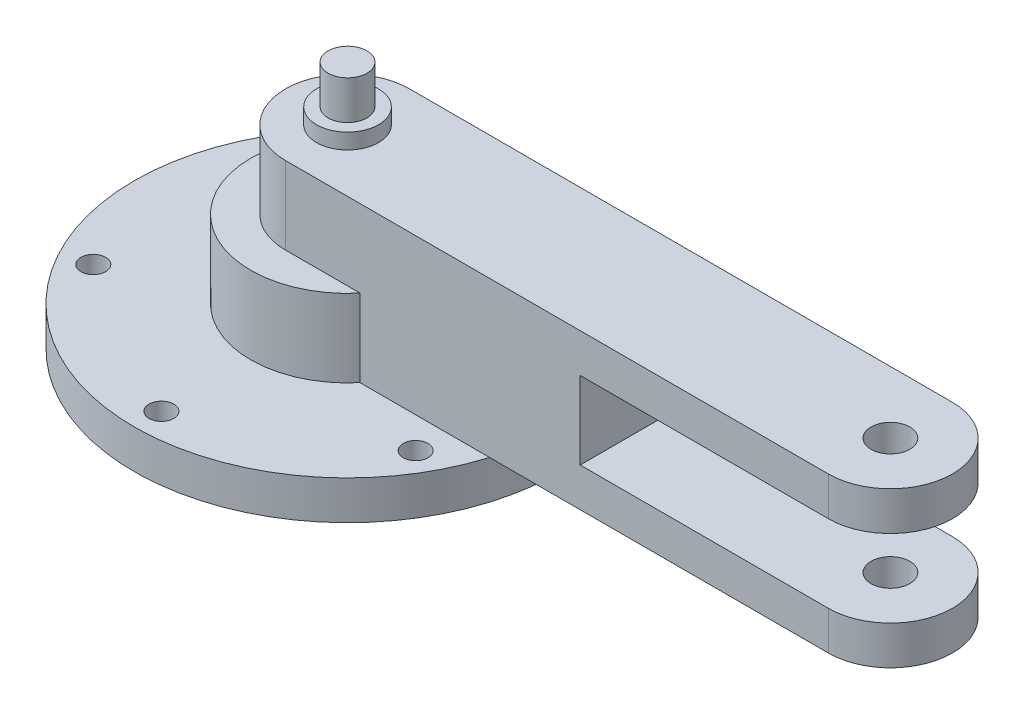
from build123d import *

# Parameters (mm, degrees)
EXTRUDE_1_DEPTH          = 10
CUT_EXTRUDE_1_REACH      = 82.25
SKETCH_3_W               = 40
SKETCH_3_H               = 10
CUT_EXTRUDE_2_REACH      = 82.92
SKETCH_4_R               = 2.5
SKETCH_5_R               = 27.5
EXTRUDE_2_DEPTH          = 5
CUT_EXTRUDE_3_REACH      = 87.09
SKETCH_6_R               = 1.6
PATTERN_CIRCULAR_1_COUNT = 6
SKETCH_7_R               = 12.5
EXTRUDE_3_DEPTH          = 10
SKETCH_8_R               = 4
EXTRUDE_4_DEPTH          = 2
SKETCH_9_R               = 2.5
EXTRUDE_5_DEPTH          = 5


with BuildPart() as part:
    # 草图2 → 凸台-拉伸1 (new, symmetric)
    with BuildSketch(Plane(origin=(0, 0, 0), x_dir=(1, 0, 0), z_dir=(0, 1, 0))):
        with BuildLine():
            Line((0, 8), (70, 8))
            ThreePointArc((70, 8), (78, 0), (70, -8))
            Line((70, -8), (0, -8))
            ThreePointArc((0, -8), (-8, 0), (0, 8))
        make_face()
    extrude(amount=EXTRUDE_1_DEPTH, both=True)

    # 草图3 → 切除-拉伸1 (cut, up to next)
    with BuildSketch(Plane.XY.offset(8), mode=Mode.PRIVATE) as cut_extrude_1_sk1:
        with Locations((58, 0)):
            Rectangle(SKETCH_3_W, SKETCH_3_H)
    cut_extrude_1_tool1 = extrude(cut_extrude_1_sk1.sketch, amount=-CUT_EXTRUDE_1_REACH, mode=Mode.PRIVATE) & part.part
    add(cut_extrude_1_tool1.solids().sort_by_distance((58, 0, 8))[0], mode=Mode.SUBTRACT)

    # 切除-拉伸2: up to this face of the body (flat: up to its plane)
    cut_extrude_2_end = Plane(part.part.faces().sort_by_distance((35, -10, 0))[0])
    # 草图4 → 切除-拉伸2 (cut, up to the picked face)
    with BuildSketch(Plane(origin=(0, 10, 0), x_dir=(1, 0, 0), z_dir=(0, 1, 0)), mode=Mode.PRIVATE) as cut_extrude_2_sk1:
        with Locations(Location((70, 0, 0), (0, 0, 270))):
            Circle(SKETCH_4_R)
    cut_extrude_2_tool1 = split(extrude(cut_extrude_2_sk1.sketch, amount=-CUT_EXTRUDE_2_REACH, mode=Mode.PRIVATE), bisect_by=cut_extrude_2_end, keep=Keep.BOTH, mode=Mode.PRIVATE)
    add(cut_extrude_2_tool1.solids().sort_by(Axis((70, 10, 0), (0, -1, 0)))[0], mode=Mode.SUBTRACT)

    # 草图5 → 凸台-拉伸2 (add)
    with BuildSketch(Plane.XZ.offset(10)):
        with Locations(Location((0, 0, 0), (0, 0, 16.912389803))):
            Circle(SKETCH_5_R)
    extrude(amount=EXTRUDE_2_DEPTH)

    # 草图6 → 切除-拉伸3 (cut, up to next)
    with BuildSketch(Plane(origin=(0, -10, 0), x_dir=(1, 0, 0), z_dir=(0, 1, 0)), mode=Mode.PRIVATE) as cut_extrude_3_sk1:
        with Locations(Location((0, 24, 0), (0, 0, 270))):
            Circle(SKETCH_6_R)
    cut_extrude_3_tool1 = extrude(cut_extrude_3_sk1.sketch, amount=-CUT_EXTRUDE_3_REACH, mode=Mode.PRIVATE) & part.part
    cut_extrude_3 = cut_extrude_3_tool1.solids().sort_by_distance((0, -10, -24))[0]
    add(cut_extrude_3, mode=Mode.SUBTRACT)

    # 阵列(圆周)1: 切除-拉伸3 ×6 about axis
    pattern_circular_1_axis = Axis((0, 0, 0), (0, 1, 0))
    for i in range(1, PATTERN_CIRCULAR_1_COUNT):
        add(cut_extrude_3.rotate(pattern_circular_1_axis, i * 360 / PATTERN_CIRCULAR_1_COUNT), mode=Mode.SUBTRACT)

    # 草图7 → 凸台-拉伸3 (add)
    with BuildSketch(Plane(origin=(0, -10, 0), x_dir=(1, 0, 0), z_dir=(0, 1, 0))):
        Circle(SKETCH_7_R)
    extrude(amount=EXTRUDE_3_DEPTH)

    # 草图8 → 凸台-拉伸4 (add)
    with BuildSketch(Plane(origin=(0, 10, 0), x_dir=(1, 0, 0), z_dir=(0, 1, 0))):
        with Locations(Location((0, 0, 0), (0, 0, 270))):
            Circle(SKETCH_8_R)
    extrude(amount=EXTRUDE_4_DEPTH)

    # 草图9 → 凸台-拉伸5 (add)
    with BuildSketch(Plane(origin=(0, 12, 0), x_dir=(1, 0, 0), z_dir=(0, 1, 0))):
        with Locations(Location((0, 0, 0), (0, 0, 270))):
            Circle(SKETCH_9_R)
    extrude(amount=EXTRUDE_5_DEPTH)


solid = part.part
